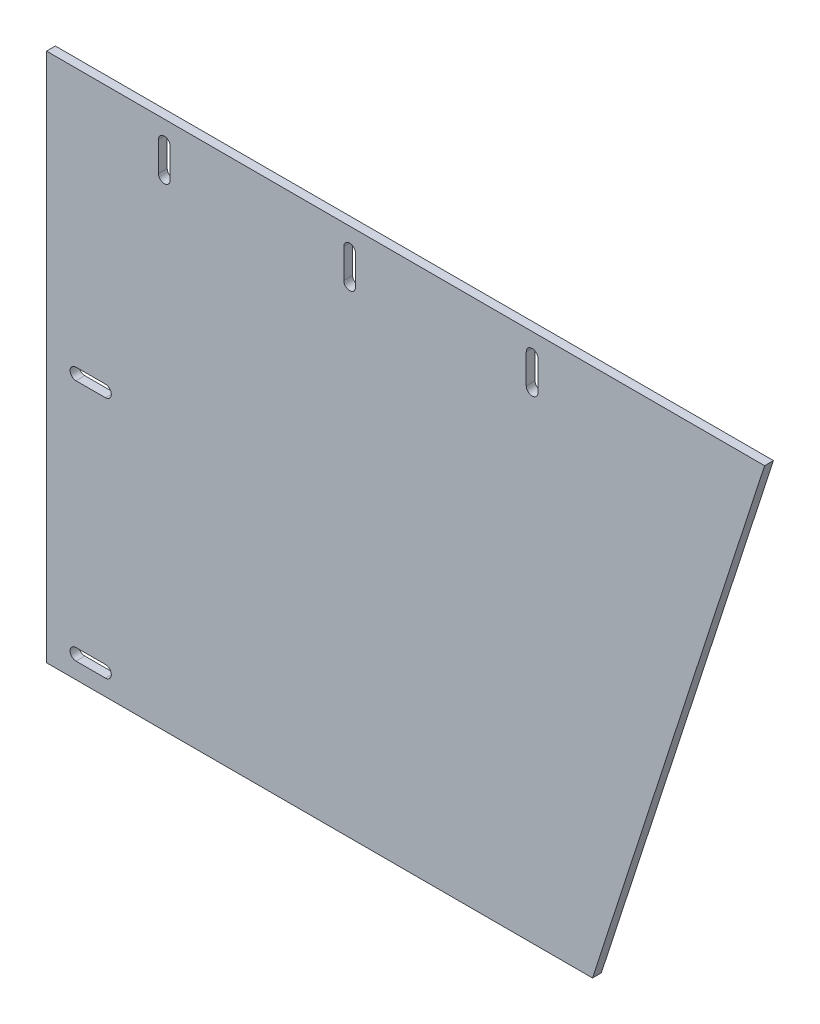
from build123d import *

# Parameters (mm, degrees)
SKETCH1_W           = 244
SKETCH1_H           = 180
BOSS_EXTRUDE1_DEPTH = 3
CUT_EXTRUDE1_DEPTH  = 3
CUT_EXTRUDE2_DEPTH  = 3


with BuildPart() as part:
    # Sketch1 → Boss-Extrude1 (new body)
    with BuildSketch(Plane.XY):
        Rectangle(SKETCH1_W, SKETCH1_H)
    extrude(amount=BOSS_EXTRUDE1_DEPTH)

    # Sketch2 → Cut-Extrude1 (cut)
    with BuildSketch(Plane.XY.offset(3)):
        Polygon((122, 90), (63.514454678, -90), (122, -90), align=None)
    extrude(amount=-CUT_EXTRUDE1_DEPTH, mode=Mode.SUBTRACT)

    # Sketch3 → Cut-Extrude2 (cut)
    with BuildSketch(Plane.XY.offset(3)):
        with BuildLine():
            Line((-80, 83), (-80, 73))
            ThreePointArc((-80, 73), (-82, 71), (-84, 73))
            Line((-84, 73), (-84, 83))
            ThreePointArc((-84, 83), (-82, 85), (-80, 83))
        make_face()
        with BuildLine():
            Line((-17, 83), (-17, 73))
            ThreePointArc((-17, 73), (-19, 71), (-21, 73))
            Line((-21, 73), (-21, 83))
            ThreePointArc((-21, 83), (-19, 85), (-17, 83))
        make_face()
        with BuildLine():
            Line((45, 83), (45, 73))
            ThreePointArc((45, 73), (43, 71), (41, 73))
            Line((41, 73), (41, 83))
            ThreePointArc((41, 83), (43, 85), (45, 83))
        make_face()
        with BuildLine():
            Line((-112, 2), (-102, 2))
            ThreePointArc((-102, 2), (-100, 0), (-102, -2))
            Line((-102, -2), (-112, -2))
            ThreePointArc((-112, -2), (-114, 0), (-112, 2))
        make_face()
        with BuildLine():
            Line((-112, -80.5), (-102, -80.5))
            ThreePointArc((-102, -80.5), (-100, -82.5), (-102, -84.5))
            Line((-102, -84.5), (-112, -84.5))
            ThreePointArc((-112, -84.5), (-114, -82.5), (-112, -80.5))
        make_face()
    extrude(amount=-CUT_EXTRUDE2_DEPTH, mode=Mode.SUBTRACT)


solid = part.part
